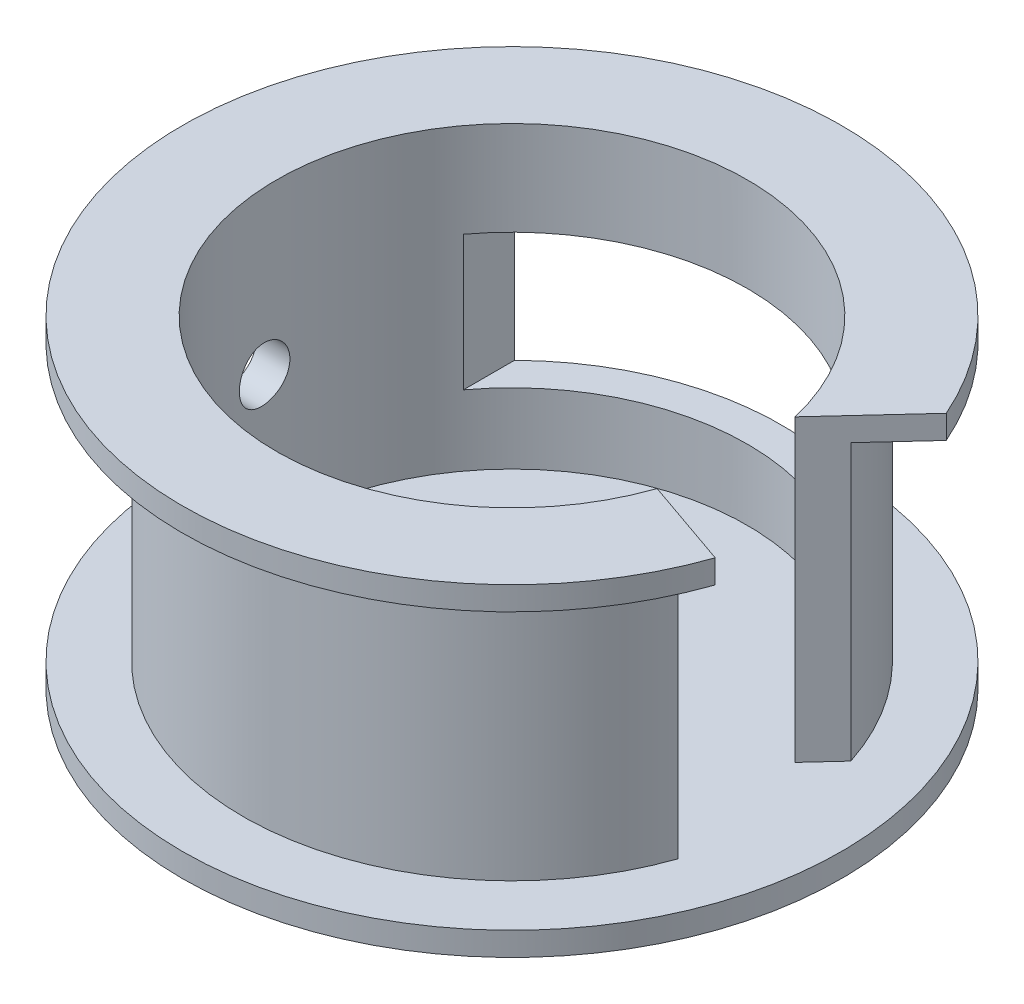
from build123d import *

# Parameters (mm, degrees)
SKETCH1_R           = 4.9
BOSS_EXTRUDE1_DEPTH = 0.35
SKETCH3_R           = 4
SKETCH3_R_2         = 3.5
BOSS_EXTRUDE2_DEPTH = 4.1
SKETCH4_R           = 4.9
SKETCH4_R_2         = 3.5
BOSS_EXTRUDE3_DEPTH = 0.35
CUT_EXTRUDE1_START  = -4.45
CUT_EXTRUDE1_DEPTH  = 4.45
SKETCH7_W           = 4.663594428
SKETCH7_H           = 2.003453707
CUT_EXTRUDE2_DEPTH  = 11.45
SKETCH8_R           = 1.6
CUT_EXTRUDE3_DEPTH  = 11.45
CUT_EXTRUDE5_DEPTH  = 11.45


with BuildPart() as part:
    # Sketch1 → Boss-Extrude1 (new body)
    with BuildSketch(Plane(origin=(0, 0, 0), x_dir=(1, 0, 0), z_dir=(0, 1, 0))):
        with Locations(Location((0, 0, 0), (0, 0, 270))):
            Circle(SKETCH1_R)
    extrude(amount=BOSS_EXTRUDE1_DEPTH)

    # Sketch3 → Boss-Extrude2 (add)
    with BuildSketch(Plane(origin=(0, 0.35, 0), x_dir=(1, 0, 0), z_dir=(0, 1, 0))):
        with Locations(Location((0, 0, 0), (0, 0, 270))):
            Circle(SKETCH3_R)
        with Locations(Location((0, 0, 0), (0, 0, 270))):
            Circle(SKETCH3_R_2, mode=Mode.SUBTRACT)
    extrude(amount=BOSS_EXTRUDE2_DEPTH)

    # Sketch4 → Boss-Extrude3 (add)
    with BuildSketch(Plane(origin=(0, 4.45, 0), x_dir=(1, 0, 0), z_dir=(0, 1, 0))):
        with Locations(Location((0, 0, 0), (0, 0, 270))):
            Circle(SKETCH4_R)
        with Locations(Location((0, 0, 0), (0, 0, 270))):
            Circle(SKETCH4_R_2, mode=Mode.SUBTRACT)
    extrude(amount=BOSS_EXTRUDE3_DEPTH)

    # Sketch5 → Cut-Extrude1 (cut)
    with BuildSketch(Plane(origin=(0, 4.8, 0), x_dir=(1, 0, 0), z_dir=(0, 1, 0)).offset(CUT_EXTRUDE1_START)):
        with BuildLine():
            Line((4.485667421, 1.972000961), (3.407070658, 0.801167605))
            ThreePointArc((3.407070658, 0.801167605), (3.476690042, 0.403269573), (3.5, 0))
            ThreePointArc((3.5, 0), (3.451272606, -0.581994331), (3.306447199, -1.147783482))
            Line((3.306447199, -1.147783482), (4.629026079, -1.606896874))
            ThreePointArc((4.629026079, -1.606896874), (4.831781648, -0.814792064), (4.9, 0))
            ThreePointArc((4.9, 0), (4.795298237, 1.007529066), (4.485667421, 1.972000961))
        make_face()
    extrude(amount=CUT_EXTRUDE1_DEPTH, mode=Mode.SUBTRACT)

    # Sketch7 → Cut-Extrude2 (cut)
    with BuildSketch(Plane.XY):
        with Locations((-0.477873166, 2.398273147)):
            Rectangle(SKETCH7_W, SKETCH7_H)
    extrude(amount=-CUT_EXTRUDE2_DEPTH, mode=Mode.SUBTRACT)

    # Sketch8 → Cut-Extrude3 (cut)
    with BuildSketch(Plane(origin=(0, 0.35, 0), x_dir=(1, 0, 0), z_dir=(0, 1, 0))):
        with Locations(Location((0, 0, 0), (0, 0, 270))):
            Circle(SKETCH8_R)
    extrude(amount=-CUT_EXTRUDE3_DEPTH, mode=Mode.SUBTRACT)

    # Sketch9 → Cut-Extrude5 (cut)
    with BuildSketch(Plane(origin=(0, 0, 0), x_dir=(0, 0, -1), z_dir=(1, 0, 0))):
        with BuildLine():
            ThreePointArc((0.192835364, 2.4), (0.075678076, 2.682842712), (-0.207164636, 2.8))
            Line((-0.207164636, 2.8), (-0.207164636, 2))
            ThreePointArc((-0.207164636, 2), (0.075678076, 2.117157288), (0.192835364, 2.4))
        make_face()
        with BuildLine():
            Line((-0.207164636, 2), (-0.207164636, 2.8))
            ThreePointArc((-0.207164636, 2.8), (-0.607164636, 2.4), (-0.207164636, 2))
        make_face()
    extrude(amount=-CUT_EXTRUDE5_DEPTH, mode=Mode.SUBTRACT)


solid = part.part
